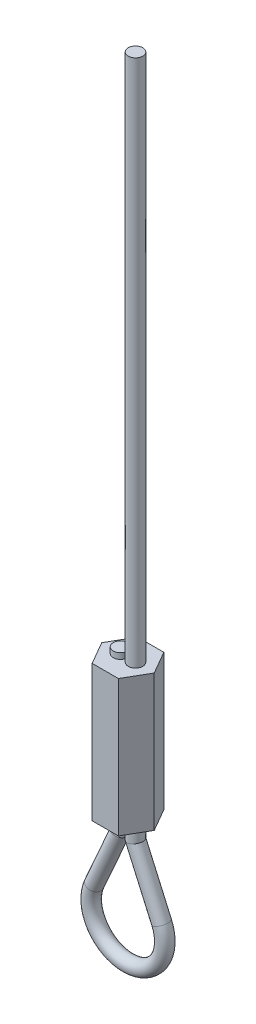
from build123d import *

# Parameters (mm, degrees)
ESBO_O2_R       = 1.6
EXTRUS_O1_DEPTH = 30


with BuildPart() as part:
    # Varredura1: sweep along a path in Esboço1
    with BuildLine(Plane.XY) as varredura1_path:
        Line((1.65, 166.275006099), (1.65, 16.275006099))
        Line((1.65, 16.275006099), (7.405965146, 3.2805))
        ThreePointArc((7.405965146, 3.2805), (0, -8.1), (-7.405965146, 3.2805))
        Line((-7.405965146, 3.2805), (-1.65, 16.275006099))
        Line((-1.65, 16.275006099), (-1.65, 51.275006099))
    # Esboço2 → Varredura1 (sweep)
    with BuildSketch(Plane(origin=(1.65, 166.275006099, 0), x_dir=(1, 0, 0), z_dir=(0, -1, 0))):
        Circle(ESBO_O2_R)
    sweep(path=varredura1_path.line, transition=Transition.RIGHT)

    # Esboço4 → Extrusão1 (add)
    with BuildSketch(Plane(origin=(0, 20, 0), x_dir=(-1, 0, 0), z_dir=(0, 1, 0))):
        Polygon((-5.773502692, 0), (-2.886751346, -5), (2.886751346, -5), (5.773502692, 0), (2.886751346, 5), (-2.886751346, 5), align=None)
    extrude(amount=EXTRUS_O1_DEPTH)


solid = part.part
